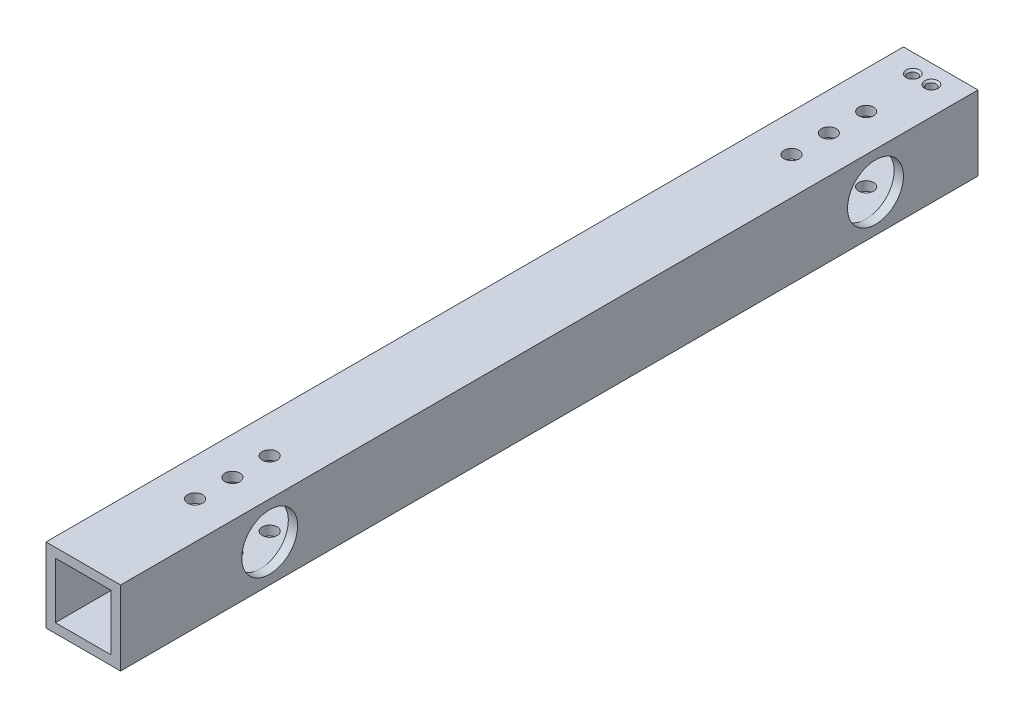
from build123d import *

# Parameters (mm, degrees)
SKETCH1_W                       = 25.4
SKETCH1_H                       = 25.4
SKETCH1_W_2                     = 19.05
SKETCH1_H_2                     = 19.05
BOSS_EXTRUDE1_DEPTH             = 292.1
F_10_CLEARANCE_HOLE1_D          = 5.1054
CUT_EXTRUDE1_REACH              = 296.3
SKETCH6_R                       = 9.525
CUT_EXTRUDE1_DIRECTION_2_DEPTH  = 295.300407747
F_4_CLEARANCE_HOLE1_D           = 3.2639
F_4_CLEARANCE_HOLE1_CSINK_D     = 4.5339
F_4_CLEARANCE_HOLE1_CSINK_ANGLE = 90
F_10_CLEARANCE_HOLE2_D          = 5.1054


with BuildPart() as part:
    # Sketch1 → Boss-Extrude1 (new body)
    with BuildSketch(Plane.XY):
        with Locations((-12.7, 12.7)):
            Rectangle(SKETCH1_W, SKETCH1_H)
        with Locations((-12.7, 12.7)):
            Rectangle(SKETCH1_W_2, SKETCH1_H_2, mode=Mode.SUBTRACT)
    extrude(amount=BOSS_EXTRUDE1_DEPTH)

    # #10 Clearance Hole1 (through all)
    with Locations(Plane(origin=(0, 25.4, 0), x_dir=(1, 0, 0), z_dir=(0, 1, 0))):
        with Locations((-12.7, -254), (-12.7, -241.3), (-12.7, -228.6)):
            Hole(F_10_CLEARANCE_HOLE1_D / 2)

    # Cut-Extrude1: up to this face of the body (flat: up to its plane)
    cut_extrude1_end = Plane(part.part.faces().sort_by_distance((0, 12.7, 146.05))[0])
    # Sketch6 → Cut-Extrude1 (cut, up to the picked face)
    with BuildSketch(Plane.ZY.offset(25.4), mode=Mode.PRIVATE) as cut_extrude1_sk1:
        with Locations(Location((241.3, 12.711043767, 0), (0, 0, 87.24065676))):
            Circle(SKETCH6_R)
    cut_extrude1_tool1 = split(extrude(cut_extrude1_sk1.sketch, amount=-CUT_EXTRUDE1_REACH, mode=Mode.PRIVATE), bisect_by=cut_extrude1_end, keep=Keep.BOTH, mode=Mode.PRIVATE)
    # Sketch6 → Cut-Extrude1 (cut, up to the picked face)
    with BuildSketch(Plane.ZY.offset(25.4), mode=Mode.PRIVATE) as cut_extrude1_sk2:
        with Locations(Location((34.925, 12.711043767, 0), (0, 0, 270))):
            Circle(SKETCH6_R)
    cut_extrude1_tool2 = split(extrude(cut_extrude1_sk2.sketch, amount=-CUT_EXTRUDE1_REACH, mode=Mode.PRIVATE), bisect_by=cut_extrude1_end, keep=Keep.BOTH, mode=Mode.PRIVATE)
    add(cut_extrude1_tool1.solids().sort_by(Axis((-25.4, 12.711044, 241.3), (1, 0, 0)))[0], mode=Mode.SUBTRACT)
    add(cut_extrude1_tool2.solids().sort_by(Axis((-25.4, 12.711044, 34.925), (1, 0, 0)))[0], mode=Mode.SUBTRACT)

    # Sketch6 → Cut-Extrude1 direction 2 (cut)
    with BuildSketch(Plane.ZY.offset(25.4)):
        with Locations(Location((241.3, 12.711043767, 0), (0, 0, 87.24065676))):
            Circle(SKETCH6_R)
        with Locations(Location((34.925, 12.711043767, 0), (0, 0, 270))):
            Circle(SKETCH6_R)
    extrude(amount=CUT_EXTRUDE1_DIRECTION_2_DEPTH, mode=Mode.SUBTRACT)

    # #4 Clearance Hole1 (through all)
    with Locations(Plane(origin=(0, 25.4, 0), x_dir=(1, 0, 0), z_dir=(0, 1, 0))):
        with Locations((-9.525, -6.35), (-15.875, -6.35)):
            CounterSinkHole(F_4_CLEARANCE_HOLE1_D / 2, F_4_CLEARANCE_HOLE1_CSINK_D / 2, counter_sink_angle=F_4_CLEARANCE_HOLE1_CSINK_ANGLE)

    # #10 Clearance Hole2 (through all)
    with Locations(Plane(origin=(0, 25.4, 0), x_dir=(1, 0, 0), z_dir=(0, 1, 0))):
        with Locations((-12.7, -50.8), (-12.7, -38.1), (-12.7, -25.4)):
            Hole(F_10_CLEARANCE_HOLE2_D / 2)


solid = part.part
